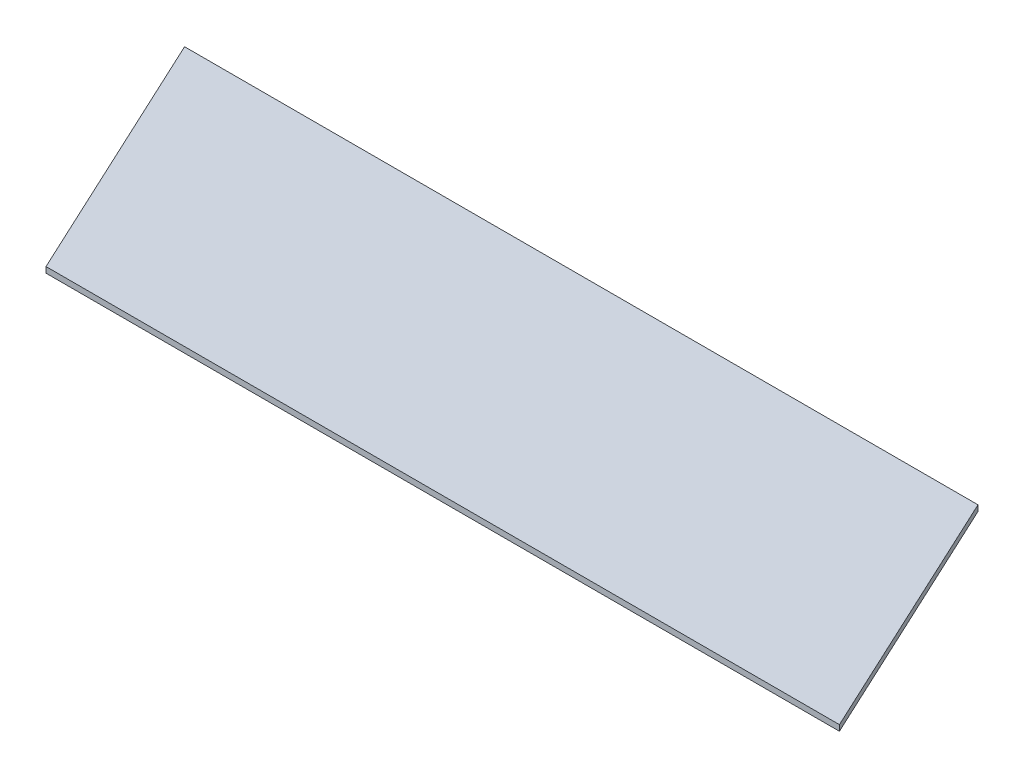
from build123d import *

# Parameters (mm, degrees)
BOSS_EXTRUDE1_DEPTH = 0.4


with BuildPart() as part:
    # Sketch1 → Boss-Extrude1 (new body)
    with BuildSketch(Plane(origin=(0, 0, 0), x_dir=(1, 0, 0), z_dir=(0, 1, 0))):
        Polygon((0, 0), (55, 0), (63.393537847, -18), (8.393537847, -18), align=None)
    extrude(amount=BOSS_EXTRUDE1_DEPTH)


solid = part.part
